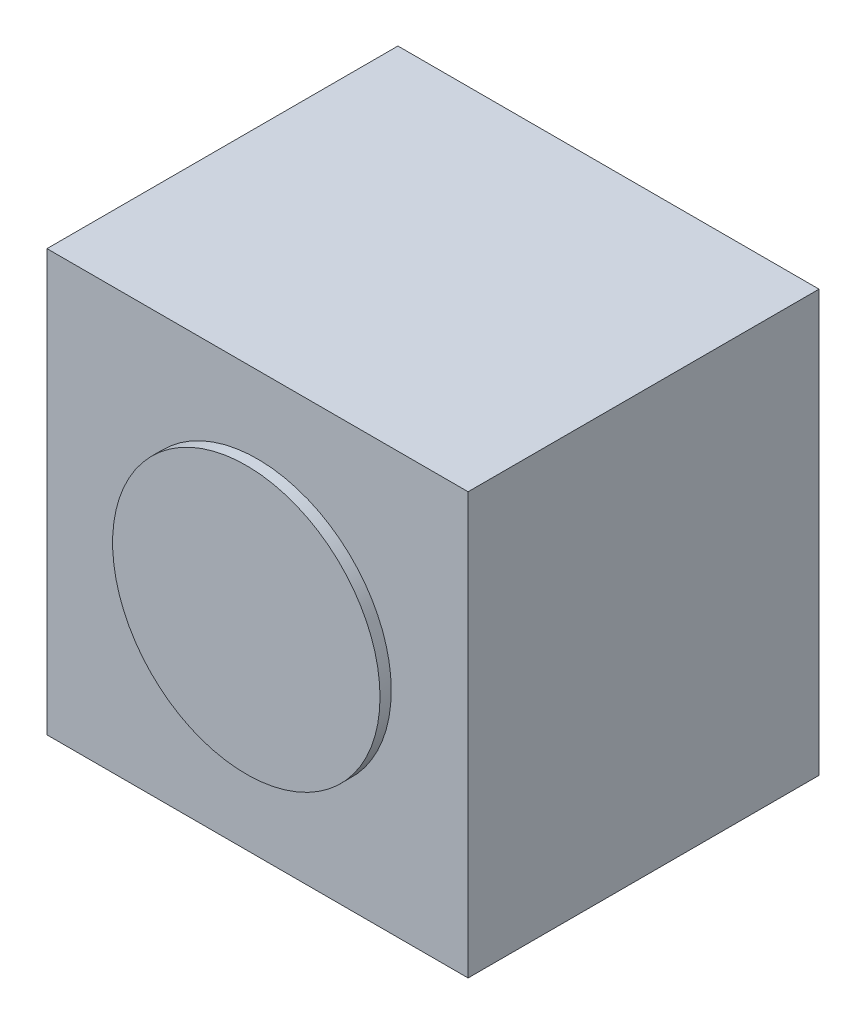
from build123d import *

# Parameters (mm, degrees)
SKETCH_1_W      = 60
SKETCH_1_H      = 60
EXTRUDE_1_DEPTH = 50
SKETCH_2_R      = 19.05
EXTRUDE_2_DEPTH = 1.6


with BuildPart() as part:
    # 스케치1 → 보스-돌출1 (new body)
    with BuildSketch(Plane.XY):
        Rectangle(SKETCH_1_W, SKETCH_1_H)
    extrude(amount=EXTRUDE_1_DEPTH)

    # 스케치2 → 보스-돌출2 (add)
    with BuildSketch(Plane.XY.offset(50)):
        Circle(SKETCH_2_R)
    extrude(amount=EXTRUDE_2_DEPTH)


solid = part.part
